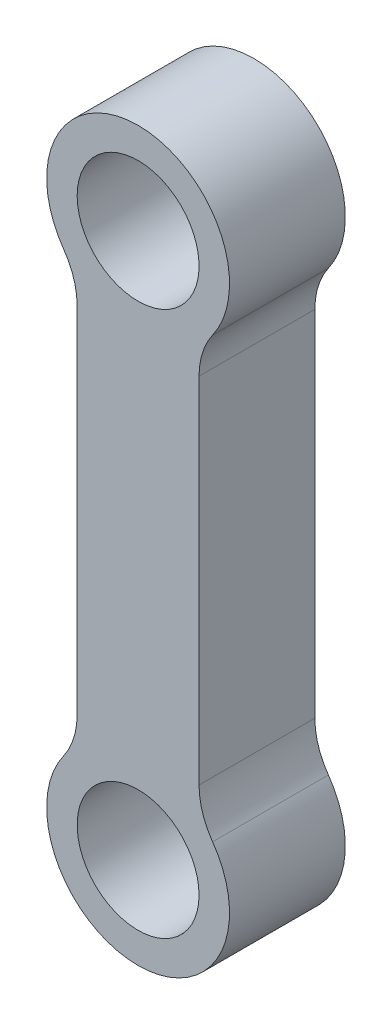
from build123d import *

# Parameters (mm, degrees)
ESBO_O1_R                = 5
RESSALTO_EXTRUS_O1_DEPTH = 9.5


with BuildPart() as part:
    # Esboço1 → Ressalto-extrusão1 (new body)
    with BuildSketch(Plane.XY):
        with BuildLine():
            Line((-5, 14.523762079), (-5, -14.523762079))
            ThreePointArc((-5, -14.523762079), (-5.284523934, -16.349503937), (-6.111111111, -18.002090044))
            ThreePointArc((-6.111111111, -18.002090044), (0, -29.85), (6.111111111, -18.002090044))
            ThreePointArc((6.111111111, -18.002090044), (5.284523934, -16.349503937), (5, -14.523762079))
            Line((5, -14.523762079), (5, 14.523762079))
            ThreePointArc((5, 14.523762079), (5.284523934, 16.349503937), (6.111111111, 18.002090044))
            ThreePointArc((6.111111111, 18.002090044), (0, 29.85), (-6.111111111, 18.002090044))
            ThreePointArc((-6.111111111, 18.002090044), (-5.284523934, 16.349503937), (-5, 14.523762079))
        make_face()
        with Locations((0, -22.35)):
            Circle(ESBO_O1_R, mode=Mode.SUBTRACT)
        with Locations(Location((0, 22.35, 0), (0, 0, 180))):
            Circle(ESBO_O1_R, mode=Mode.SUBTRACT)
    extrude(amount=RESSALTO_EXTRUS_O1_DEPTH)


solid = part.part
